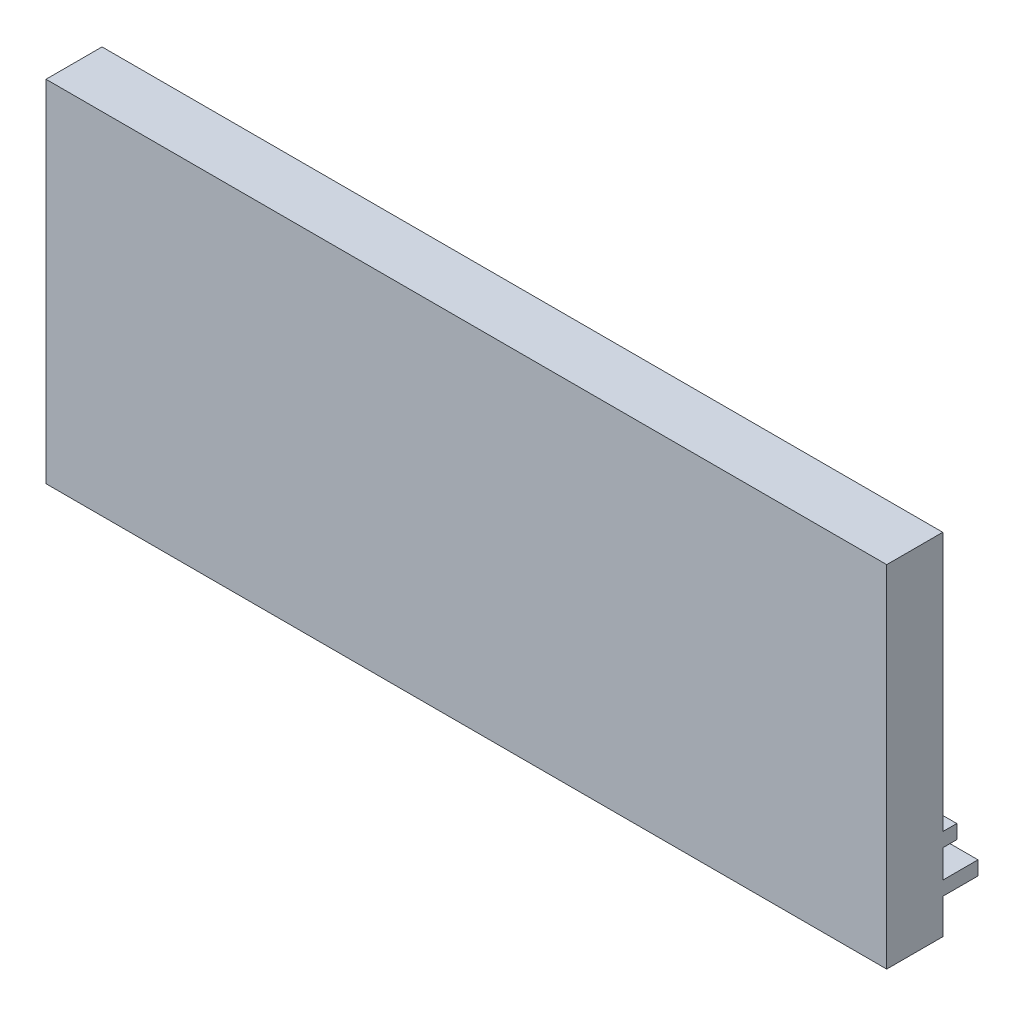
from build123d import *
from build123d.topology import SkipClean

# Parameters (mm, degrees)
SKETCH1_W           = 60
SKETCH1_H           = 25
BOSS_EXTRUDE1_DEPTH = 4
SKETCH2_W           = 40
SKETCH2_H           = 1
BOSS_EXTRUDE2_DEPTH = 2.5146
SKETCH3_W           = 40
SKETCH3_H           = 1
BOSS_EXTRUDE3_DEPTH = 1


with BuildPart() as part:
    # Sketch1 → Boss-Extrude1 (new body)
    with BuildSketch(Plane.XY):
        with Locations((4.416243655, 2.220812183)):
            Rectangle(SKETCH1_W, SKETCH1_H)
    extrude(amount=BOSS_EXTRUDE1_DEPTH)

    # Sketch2 → Boss-Extrude2 (add)
    with BuildSketch(Plane(origin=(0, 0, 0), x_dir=(-1, 0, 0), z_dir=(0, 0, -1))):
        with Locations((-14.416243533, -7.279192817)):
            Rectangle(SKETCH2_W, SKETCH2_H)
    extrude(amount=BOSS_EXTRUDE2_DEPTH)

    # Sketch3 → Boss-Extrude3 (add)
    with SkipClean():  # the faces are left unmerged after this step: merging them gives an invalid solid
        with BuildSketch(Plane(origin=(0, 0, 0), x_dir=(-1, 0, 0), z_dir=(0, 0, -1))):
            with Locations((-14.416243533, -4.279192817)):
                Rectangle(SKETCH3_W, SKETCH3_H)
        extrude(amount=BOSS_EXTRUDE3_DEPTH)


solid = part.part
